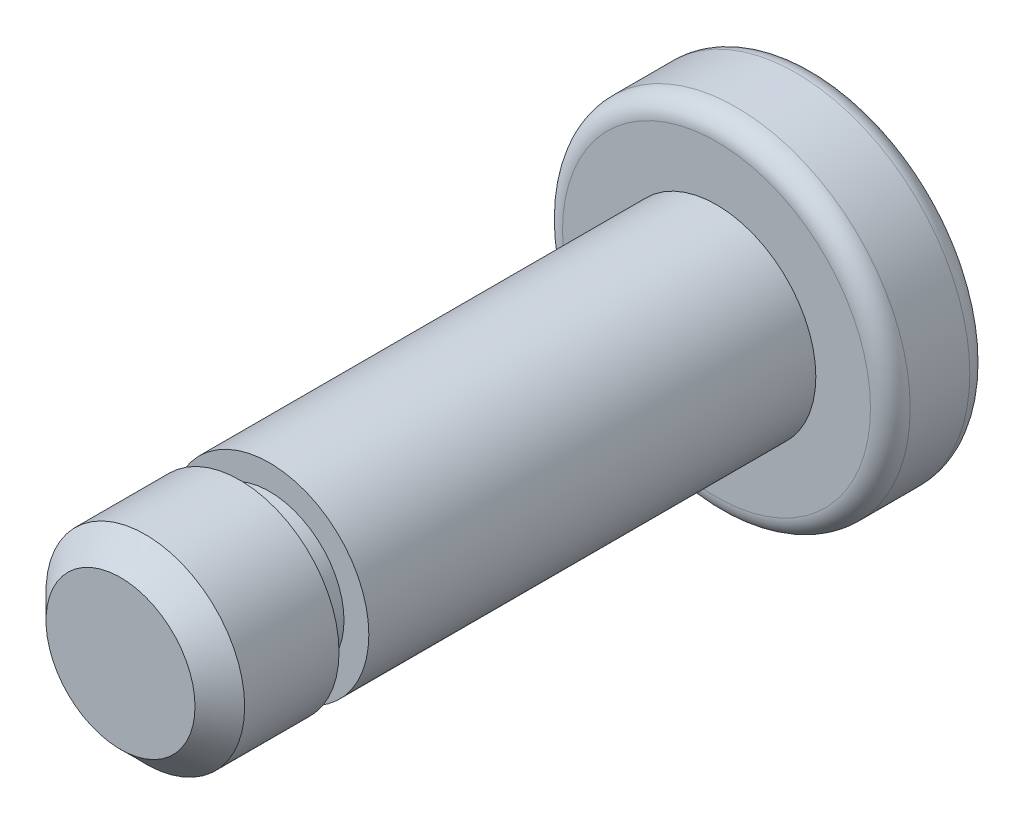
from build123d import *

# Parameters (mm, degrees)
SKETCH_1_R          = 3.5
EXTRUDE_1_DEPTH     = 2
SKETCH_2_R          = 2
EXTRUDE_2_DEPTH     = 12
CUT_EXTRUDE_START   = -3
SKETCH_3_R          = 2
SKETCH_3_R_2        = 1.5
CUT_EXTRUDE_1_DEPTH = 0.6
CHAMFER_1_SIZE      = 0.5
FILLET_1_R          = 0.4


with BuildPart() as part:
    # 草图1 → 凸台-拉伸1 (new body)
    with BuildSketch(Plane.XY):
        Circle(SKETCH_1_R)
    extrude(amount=EXTRUDE_1_DEPTH)

    # 草图2 → 凸台-拉伸2 (add)
    with BuildSketch(Plane.XY.offset(2)):
        Circle(SKETCH_2_R)
    extrude(amount=EXTRUDE_2_DEPTH)

    # 草图3 → 切除-拉伸1 (cut)
    with BuildSketch(Plane.XY.offset(14).offset(CUT_EXTRUDE_START)):
        Circle(SKETCH_3_R)
        Circle(SKETCH_3_R_2, mode=Mode.SUBTRACT)
    extrude(amount=CUT_EXTRUDE_1_DEPTH, mode=Mode.SUBTRACT)

    # 倒角1
    chamfer_1_edges = [part.edges().sort_by_distance(p)[0] for p in [
        (-2, 0, 14),
    ]]
    chamfer(chamfer_1_edges, length=CHAMFER_1_SIZE)

    # 圆角1
    fillet_1_edges = [part.edges().sort_by_distance(p)[0] for p in [
        (-3.5, 0, 0),
        (-3.5, 0, 2),
    ]]
    fillet(fillet_1_edges, radius=FILLET_1_R)


solid = part.part
